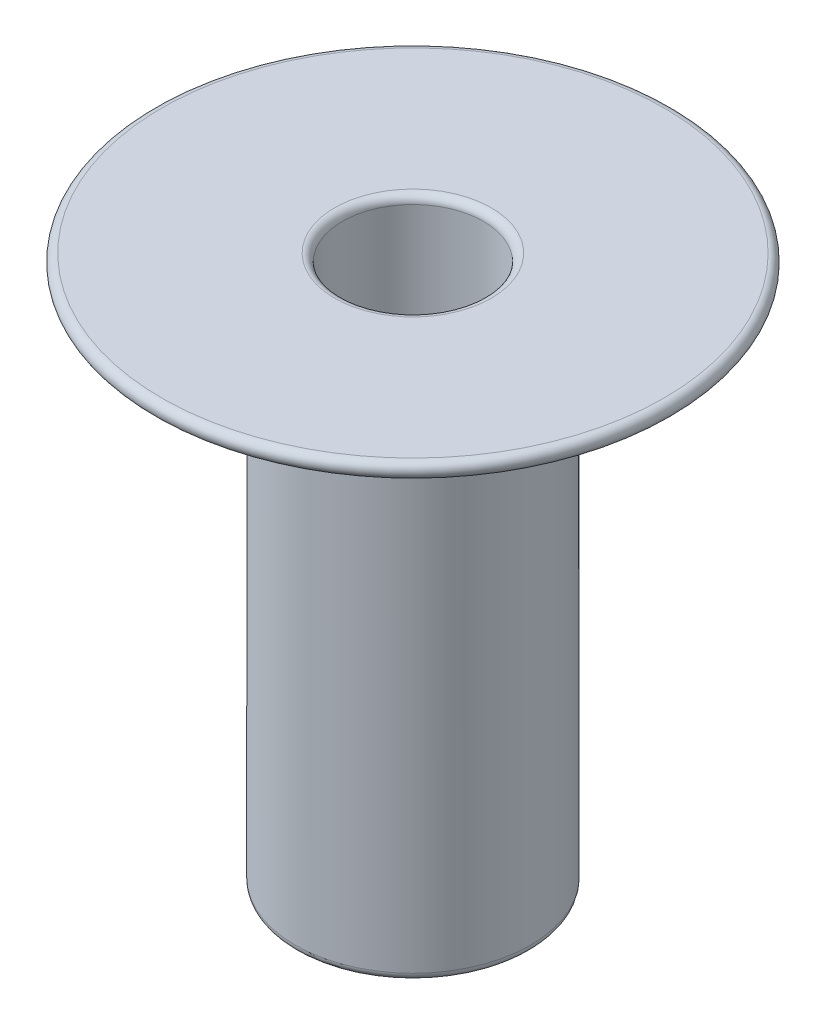
from build123d import *

# Parameters (mm, degrees)
FILLET_1_R = 0.1


with BuildPart() as part:
    # 草图1 → 旋转1 (revolve)
    with BuildSketch(Plane.XY, mode=Mode.PRIVATE) as revolve_1_sk:
        Polygon((-0.9, 2.4), (-3.578460969, 2.4), (-1.5, 1.2), (-1.5, -4.6), (0, -4.6), (0, 0), (-0.9, 0), align=None)
    revolve(revolve_1_sk.sketch.rotate(Axis((0, -4.6, 0), (0, 1, 0)), 180), axis=Axis((0, -4.6, 0), (0, 1, 0)))

    # 圆角1
    fillet_1_edges = [part.edges().sort_by_distance(p)[0] for p in [
        (-0.9, 0, 0),
        (-1.5, -4.6, 0),
        (-3.578460969, 2.4, 0),
        (-0.9, 2.4, 0),
    ]]
    fillet(fillet_1_edges, radius=FILLET_1_R)


solid = part.part
